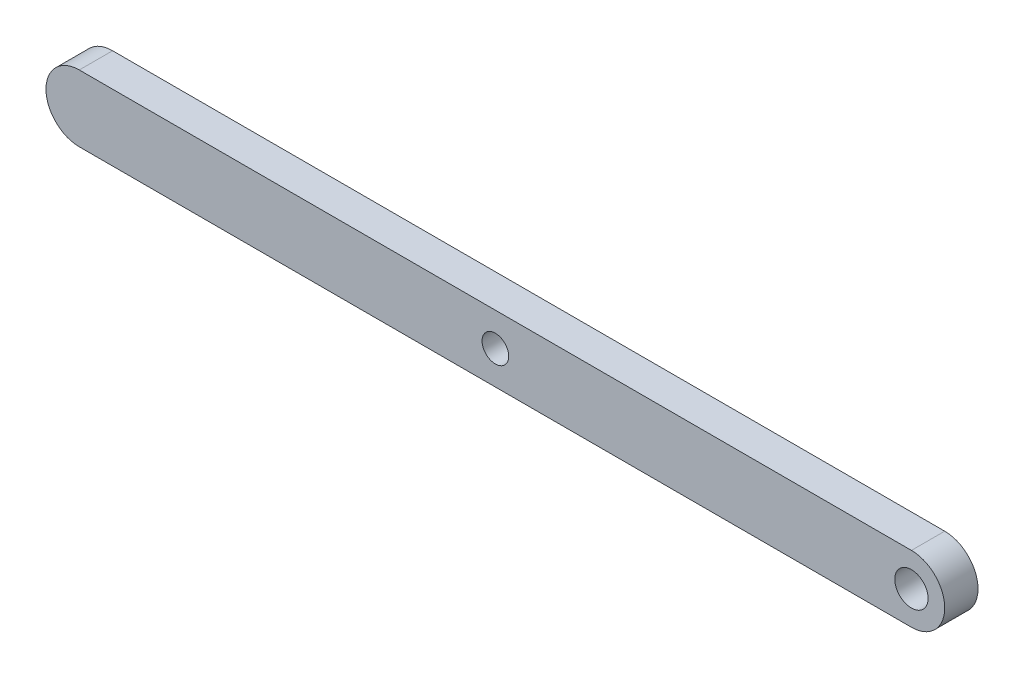
from build123d import *

# Parameters (mm, degrees)
SKETCH1_R           = 4
SKETCH1_R_2         = 5
BOSS_EXTRUDE1_DEPTH = 10


with BuildPart() as part:
    # Sketch1 → Boss-Extrude1 (new body)
    with BuildSketch(Plane.XY):
        with BuildLine():
            Line((125, -10), (-125, -10))
            ThreePointArc((-125, -10), (-135, 0), (-125, 10))
            Line((-125, 10), (125, 10))
            ThreePointArc((125, 10), (135, 0), (125, -10))
        make_face()
        Circle(SKETCH1_R, mode=Mode.SUBTRACT)
        with Locations((125, 0)):
            Circle(SKETCH1_R_2, mode=Mode.SUBTRACT)
    extrude(amount=BOSS_EXTRUDE1_DEPTH)


solid = part.part
